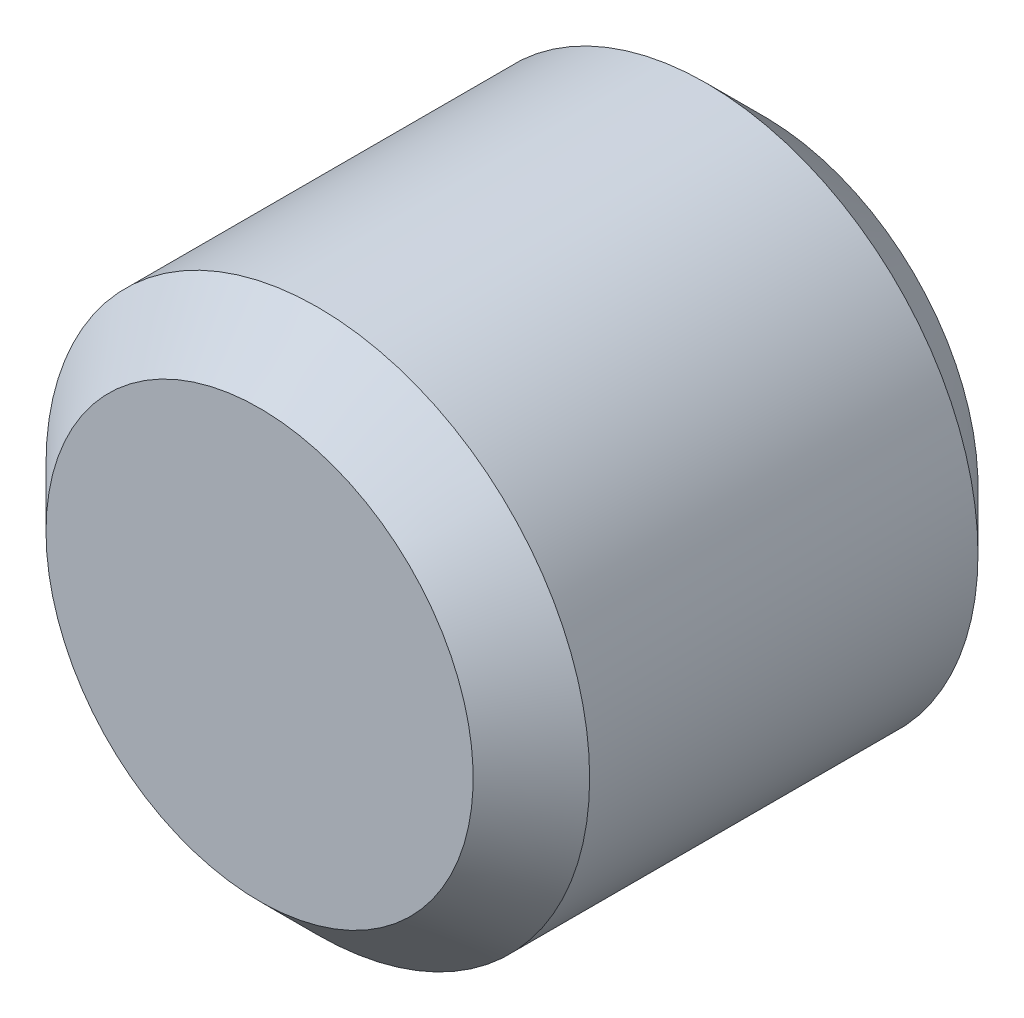
from build123d import *

# Parameters (mm, degrees)
CHAMFER1_SIZE = 3


with BuildPart() as part:
    # Sketch1 → Revolve1 (revolve)
    with BuildSketch(Plane(origin=(0, 0, 0), x_dir=(1, 0, 0), z_dir=(0, 1, 0))):
        Polygon((0, 0), (-14, 0), (-14, 26), (-1.5, 26), (-1.5, 29.2), (0, 29.2), align=None)
    revolve(axis=Axis((0, 0, -29.2), (0, 0, 1)))

    # Chamfer1
    chamfer1_edges = [part.edges().sort_by_distance(p)[0] for p in [
        (14, 0, -26),
        (14, 0, 0),
    ]]
    chamfer(chamfer1_edges, length=CHAMFER1_SIZE)


solid = part.part
